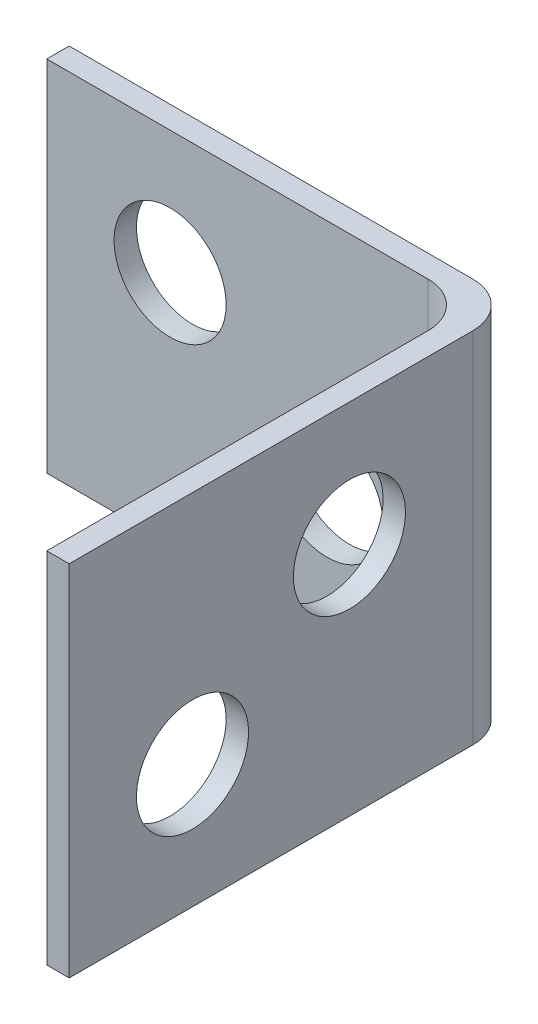
from build123d import *

# Parameters (mm, degrees)
SKETCH_1_W          = 20
SKETCH_1_H          = 16
SKETCH_1_R          = 2.5
EXTRUDE_1_DEPTH     = 1
SKETCH_2_W          = 1
SKETCH_2_H          = 16
EXTRUDE_2_DEPTH     = 19
SKETCH_3_R          = 2.5
CUT_EXTRUDE_1_DEPTH = 32.890437438
FILLET_2_R          = 2


with BuildPart() as part:
    # 草图1 → 凸台-拉伸1 (new body)
    with BuildSketch(Plane.XY):
        with Locations((10, 8)):
            Rectangle(SKETCH_1_W, SKETCH_1_H)
        with Locations((5.5, 10.5)):
            Circle(SKETCH_1_R, mode=Mode.SUBTRACT)
        with Locations((12.5, 5.5)):
            Circle(SKETCH_1_R, mode=Mode.SUBTRACT)
    extrude(amount=EXTRUDE_1_DEPTH)

    # 草图2 → 凸台-拉伸2 (add)
    with BuildSketch(Plane.XY.offset(1)):
        with Locations((19.5, 8)):
            Rectangle(SKETCH_2_W, SKETCH_2_H)
    extrude(amount=EXTRUDE_2_DEPTH)

    # 草图3 → 切除-拉伸1 (cut, through all)
    with BuildSketch(Plane.ZY.offset(-19)):
        with Locations(Location((7.5, 10.5, 0), (0, 0, 270))):
            Circle(SKETCH_3_R)
        with Locations(Location((14.5, 5.5, 0), (0, 0, 270))):
            Circle(SKETCH_3_R)
    extrude(amount=-CUT_EXTRUDE_1_DEPTH, mode=Mode.SUBTRACT)

    # 圆角2
    fillet_2_edges = [part.edges().sort_by_distance(p)[0] for p in [
        (19, 8, 1),
        (20, 8, 0),
    ]]
    fillet(fillet_2_edges, radius=FILLET_2_R)


solid = part.part
